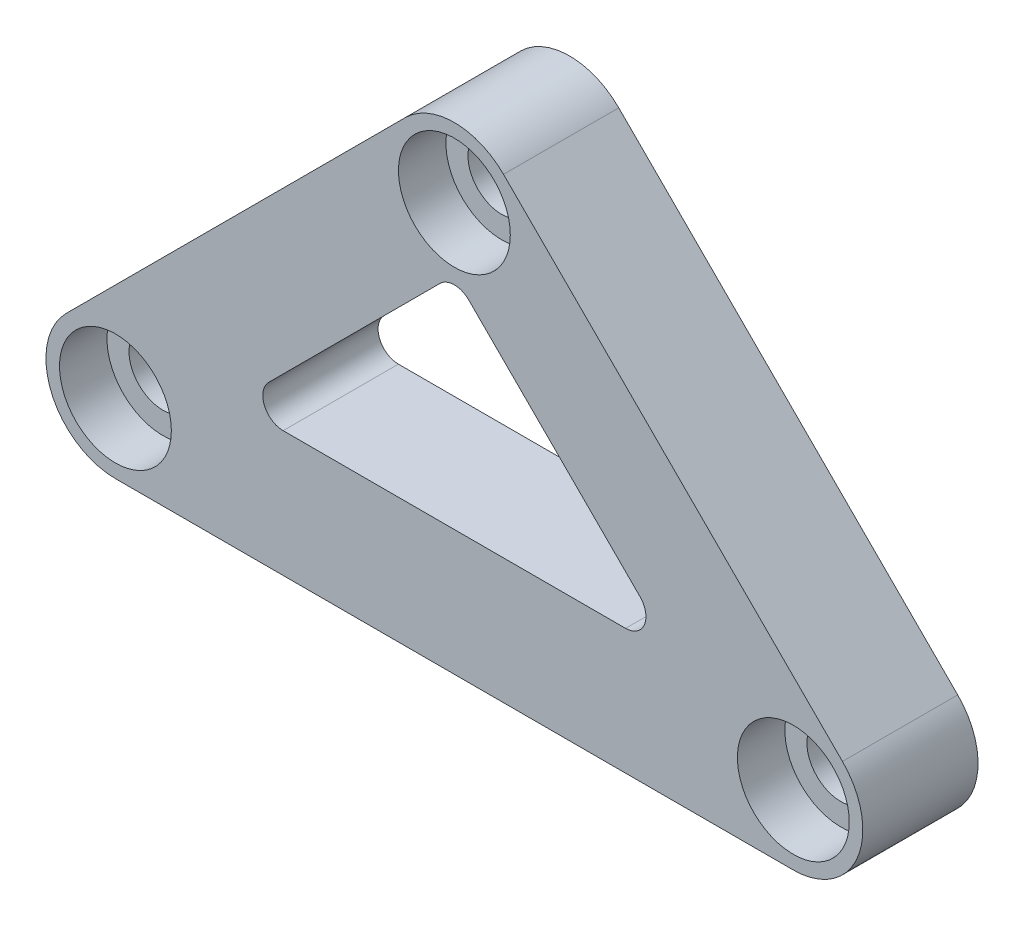
from build123d import *

# Parameters (mm, degrees)
BOSS_EXTRUDE4_DEPTH = 17
SKETCH3_R           = 8.25
CUT_EXTRUDE1_DEPTH  = 7
CUT_EXTRUDE2_START  = -7
SKETCH4_R           = 8.25
CUT_EXTRUDE2_DEPTH  = 7
CUT_EXTRUDE3_DEPTH  = 127.783772621
SKETCH6_R           = 5
CUT_EXTRUDE4_DEPTH  = 16.6
FILLET1_R           = 3


with BuildPart() as part:
    # Sketch2 → Boss-Extrude4 (new body)
    with BuildSketch(Plane.XY):
        with BuildLine():
            Line((-100, 10.25), (0, 10.25))
            ThreePointArc((0, 10.25), (10.25, 0), (0, -10.25))
            Line((0, -10.25), (-100, -10.25))
            ThreePointArc((-100, -10.25), (-110.25, 0), (-100, 10.25))
        make_face()
        with BuildLine():
            Line((-7.247844507, -7.247844507), (-57.247844507, 42.752155493))
            ThreePointArc((-57.247844507, 42.752155493), (-57.247844507, 57.247844507), (-42.752155493, 57.247844507))
            Line((-42.752155493, 57.247844507), (7.247844507, 7.247844507))
            ThreePointArc((7.247844507, 7.247844507), (7.247844507, -7.247844507), (-7.247844507, -7.247844507))
        make_face()
        with BuildLine():
            Line((-107.247844507, 7.247844507), (-57.247844507, 57.247844507))
            ThreePointArc((-57.247844507, 57.247844507), (-42.752155493, 57.247844507), (-42.752155493, 42.752155493))
            Line((-42.752155493, 42.752155493), (-92.752155493, -7.247844507))
            ThreePointArc((-92.752155493, -7.247844507), (-107.247844507, -7.247844507), (-107.247844507, 7.247844507))
        make_face()
    extrude(amount=BOSS_EXTRUDE4_DEPTH)

    # Sketch3 → Cut-Extrude1 (cut)
    with BuildSketch(Plane(origin=(0, 0, 0), x_dir=(-1, 0, 0), z_dir=(0, 0, -1))):
        Circle(SKETCH3_R)
        with Locations((50, 50)):
            Circle(SKETCH3_R)
        with Locations((100, 0)):
            Circle(SKETCH3_R)
    extrude(amount=-CUT_EXTRUDE1_DEPTH, mode=Mode.SUBTRACT)

    # Sketch4 → Cut-Extrude2 (cut)
    with BuildSketch(Plane.XY.offset(17).offset(CUT_EXTRUDE2_START)):
        with Locations(Location((-100, 0, 0), (0, 0, 180))):
            Circle(SKETCH4_R)
        with Locations(Location((-50, 50, 0), (0, 0, 180))):
            Circle(SKETCH4_R)
        with Locations(Location((0, 0, 0), (0, 0, 180))):
            Circle(SKETCH4_R)
    extrude(amount=CUT_EXTRUDE2_DEPTH, mode=Mode.SUBTRACT)

    # Sketch5 → Cut-Extrude3 (cut, through all)
    with BuildSketch(Plane(origin=(0, 0, 0), x_dir=(-1, 0, 0), z_dir=(0, 0, -1))):
        Polygon((17.5, 8.25), (50, 40.75), (82.5, 8.25), align=None)
    extrude(amount=-CUT_EXTRUDE3_DEPTH, mode=Mode.SUBTRACT)

    # Sketch6 → Cut-Extrude4 (cut)
    with BuildSketch(Plane.XY.offset(17)):
        with Locations((-100, 0)):
            Circle(SKETCH6_R)
        with Locations((-50, 50)):
            Circle(SKETCH6_R)
        Circle(SKETCH6_R)
    extrude(amount=-CUT_EXTRUDE4_DEPTH, mode=Mode.SUBTRACT)

    # Fillet1
    fillet1_edges = [part.edges().sort_by_distance(p)[0] for p in [
        (-82.5, 8.25, 8.5),
        (-17.5, 8.25, 8.5),
        (-50, 40.75, 8.5),
    ]]
    fillet(fillet1_edges, radius=FILLET1_R)


solid = part.part
